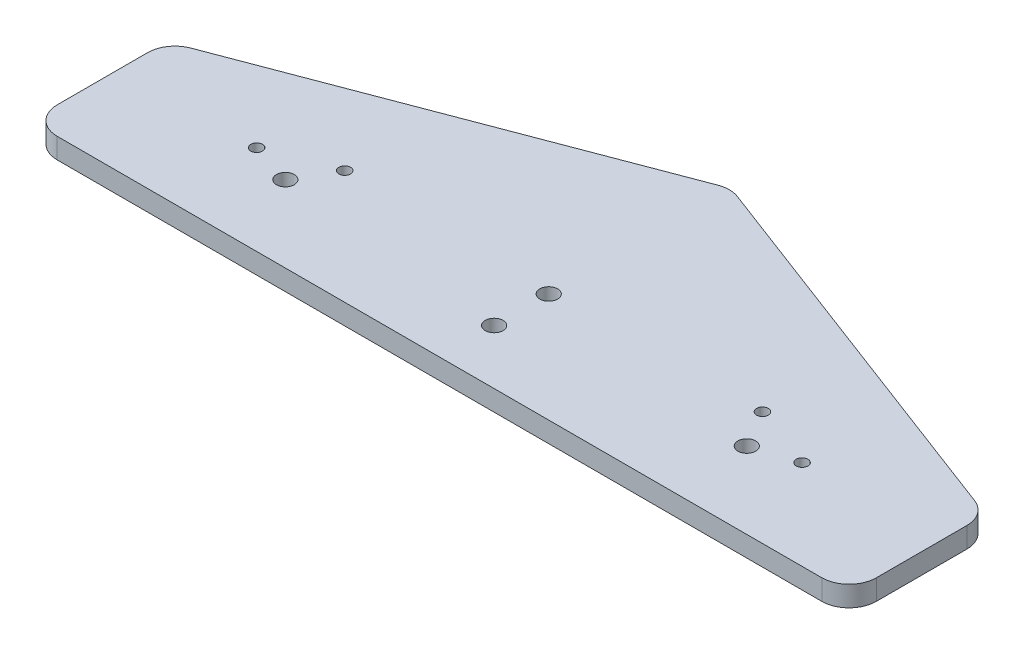
from build123d import *

# Parameters (mm, degrees)
BOSS_EXTRUDE1_DEPTH     = 7.5
F_1_4_CLEARANCE_HOLE4_D = 6.5278
M4_CLEARANCE_HOLE1_D    = 4.3


with BuildPart() as part:
    # Sketch2 → Boss-Extrude1 (new body)
    with BuildSketch(Plane(origin=(0, 0, 0), x_dir=(1, 0, 0), z_dir=(0, 1, 0))):
        with BuildLine():
            Line((0, 0), (140, 0))
            ThreePointArc((140, 0), (147.071067812, 2.928932188), (150, 10))
            Line((150, 10), (150, 43.095020321))
            ThreePointArc((150, 43.095020321), (148.228885216, 48.777048841), (143.54291038, 52.446372418))
            Line((143.54291038, 52.446372418), (3.54291038, 105.487627635))
            ThreePointArc((3.54291038, 105.487627635), (0, 106.136275538), (-3.54291038, 105.487627635))
            Line((-3.54291038, 105.487627635), (-143.54291038, 52.446372418))
            ThreePointArc((-143.54291038, 52.446372418), (-148.228885216, 48.777048841), (-150, 43.095020321))
            Line((-150, 43.095020321), (-150, 10))
            ThreePointArc((-150, 10), (-147.071067812, 2.928932188), (-140, 0))
            Line((-140, 0), (0, 0))
        make_face()
    extrude(amount=-BOSS_EXTRUDE1_DEPTH)

    # 1/4 Clearance Hole4 (through all)
    with Locations(Plane(origin=(0, 0, 0), x_dir=(1, 0, 0), z_dir=(0, 1, 0))):
        with Locations((84.499767088, 28.031140011), (-84.499767088, 28.031140011), (0, 40), (0, 20)):
            Hole(F_1_4_CLEARANCE_HOLE4_D / 2)

    # M4 Clearance Hole1 (through all)
    with Locations(Plane(origin=(0, 0, 0), x_dir=(1, 0, 0), z_dir=(0, 1, 0))):
        with Locations((-76.49119694, 41.758956585), (-99.869577175, 32.901680638), (76.49119694, 41.758956585), (99.869577175, 32.901680638)):
            Hole(M4_CLEARANCE_HOLE1_D / 2)


solid = part.part
